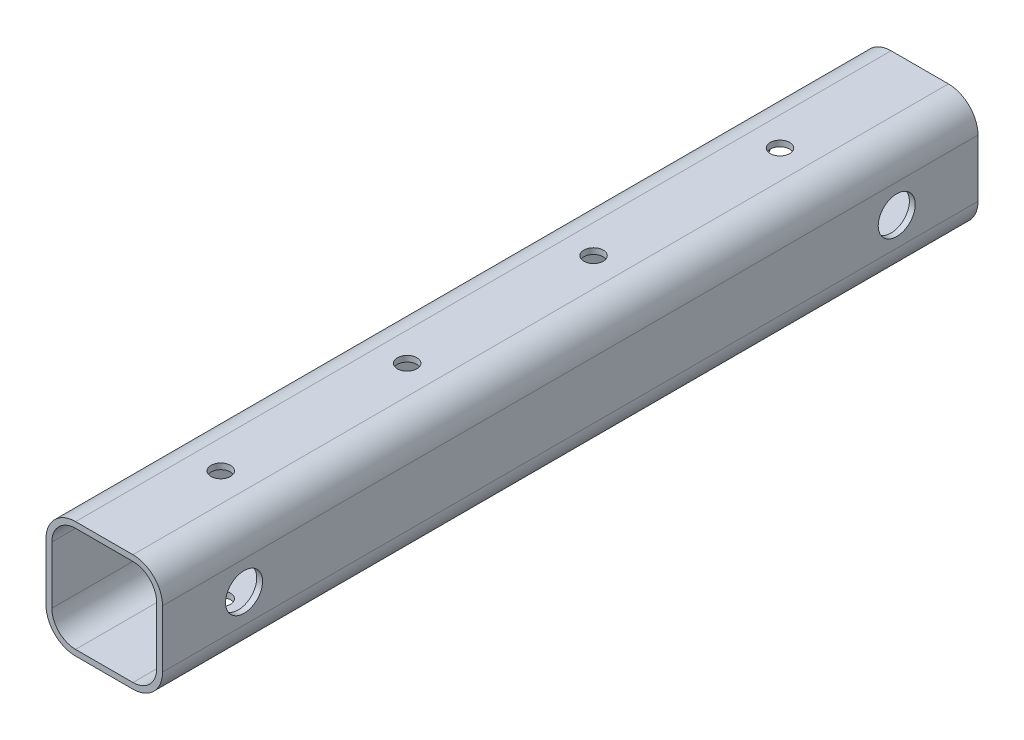
from build123d import *

# Parameters (mm, degrees)
SQUARE_TUBE_2_X_2_X_0_25_1_DEPTH = 350
CUT_EXTRUDE1_REACH               = 356.436
SKETCH16_R                       = 7.9375
CUT_EXTRUDE2_REACH               = 356.436
SKETCH18_R                       = 7.9375
CUT_EXTRUDE3_REACH               = 356.436
SKETCH19_R                       = 4.1671875


with BuildPart() as part:
    # Sketch15 → Square tube 2 X 2 X 0.25(1) (new body)
    with BuildSketch(Plane.YX):
        with BuildLine():
            Line((-12.3, -25), (12.3, -25))
            ThreePointArc((12.3, -25), (21.280256121, -21.280256121), (25, -12.3))
            Line((25, -12.3), (25, 12.3))
            ThreePointArc((25, 12.3), (21.280256121, 21.280256121), (12.3, 25))
            Line((12.3, 25), (-12.3, 25))
            ThreePointArc((-12.3, 25), (-21.280256121, 21.280256121), (-25, 12.3))
            Line((-25, 12.3), (-25, -12.3))
            ThreePointArc((-25, -12.3), (-21.280256121, -21.280256121), (-12.3, -25))
        make_face()
        with BuildLine():
            Line((-12.3, -22.5), (12.3, -22.5))
            ThreePointArc((12.3, -22.5), (19.512489168, -19.512489168), (22.5, -12.3))
            Line((22.5, -12.3), (22.5, 12.3))
            ThreePointArc((22.5, 12.3), (19.512489168, 19.512489168), (12.3, 22.5))
            Line((12.3, 22.5), (-12.3, 22.5))
            ThreePointArc((-12.3, 22.5), (-19.512489168, 19.512489168), (-22.5, 12.3))
            Line((-22.5, 12.3), (-22.5, -12.3))
            ThreePointArc((-22.5, -12.3), (-19.512489168, -19.512489168), (-12.3, -22.5))
        make_face(mode=Mode.SUBTRACT)
    extrude(amount=SQUARE_TUBE_2_X_2_X_0_25_1_DEPTH)

    # Cut-Extrude1: up to this face of the body (flat: up to its plane)
    cut_extrude1_end = Plane(part.part.faces().sort_by_distance((25, 0, -175))[0])
    # Sketch16 → Cut-Extrude1 (cut, up to the picked face)
    with BuildSketch(Plane.ZY.offset(25), mode=Mode.PRIVATE) as cut_extrude1_sk1:
        with Locations((-35, 0)):
            Circle(SKETCH16_R)
    cut_extrude1_tool1 = split(extrude(cut_extrude1_sk1.sketch, amount=-CUT_EXTRUDE1_REACH, mode=Mode.PRIVATE), bisect_by=cut_extrude1_end, keep=Keep.BOTH, mode=Mode.PRIVATE)
    add(cut_extrude1_tool1.solids().sort_by(Axis((-25, 0, -35), (1, 0, 0)))[0], mode=Mode.SUBTRACT)

    # Cut-Extrude2: up to this face of the body (flat: up to its plane)
    cut_extrude2_end = Plane(part.part.faces().sort_by_distance((25, 0, -178.294144468))[0])
    # Sketch18 → Cut-Extrude2 (cut, up to the picked face)
    with BuildSketch(Plane.ZY.offset(25), mode=Mode.PRIVATE) as cut_extrude2_sk1:
        with Locations((-315.113369307, 0)):
            Circle(SKETCH18_R)
    cut_extrude2_tool1 = split(extrude(cut_extrude2_sk1.sketch, amount=-CUT_EXTRUDE2_REACH, mode=Mode.PRIVATE), bisect_by=cut_extrude2_end, keep=Keep.BOTH, mode=Mode.PRIVATE)
    add(cut_extrude2_tool1.solids().sort_by(Axis((-25, 0, -315.113369), (1, 0, 0)))[0], mode=Mode.SUBTRACT)

    # Cut-Extrude3: up to this face of the body (flat: up to its plane)
    cut_extrude3_end = Plane(part.part.faces().sort_by_distance((0, -25, -175))[0])
    # Sketch19 → Cut-Extrude3 (cut, up to the picked face)
    with BuildSketch(Plane(origin=(0, 25, 0), x_dir=(-1, 0, 0), z_dir=(0, 1, 0)), mode=Mode.PRIVATE) as cut_extrude3_sk1:
        with Locations(Location((0, -290, 0), (0, 0, 90))):
            Circle(SKETCH19_R)
    cut_extrude3_tool1 = split(extrude(cut_extrude3_sk1.sketch, amount=-CUT_EXTRUDE3_REACH, mode=Mode.PRIVATE), bisect_by=cut_extrude3_end, keep=Keep.BOTH, mode=Mode.PRIVATE)
    # Sketch19 → Cut-Extrude3 (cut, up to the picked face)
    with BuildSketch(Plane(origin=(0, 25, 0), x_dir=(-1, 0, 0), z_dir=(0, 1, 0)), mode=Mode.PRIVATE) as cut_extrude3_sk2:
        with Locations(Location((0, -210, 0), (0, 0, 90))):
            Circle(SKETCH19_R)
    cut_extrude3_tool2 = split(extrude(cut_extrude3_sk2.sketch, amount=-CUT_EXTRUDE3_REACH, mode=Mode.PRIVATE), bisect_by=cut_extrude3_end, keep=Keep.BOTH, mode=Mode.PRIVATE)
    # Sketch19 → Cut-Extrude3 (cut, up to the picked face)
    with BuildSketch(Plane(origin=(0, 25, 0), x_dir=(-1, 0, 0), z_dir=(0, 1, 0)), mode=Mode.PRIVATE) as cut_extrude3_sk3:
        with Locations(Location((0, -130, 0), (0, 0, 90))):
            Circle(SKETCH19_R)
    cut_extrude3_tool3 = split(extrude(cut_extrude3_sk3.sketch, amount=-CUT_EXTRUDE3_REACH, mode=Mode.PRIVATE), bisect_by=cut_extrude3_end, keep=Keep.BOTH, mode=Mode.PRIVATE)
    # Sketch19 → Cut-Extrude3 (cut, up to the picked face)
    with BuildSketch(Plane(origin=(0, 25, 0), x_dir=(-1, 0, 0), z_dir=(0, 1, 0)), mode=Mode.PRIVATE) as cut_extrude3_sk4:
        with Locations(Location((0, -50, 0), (0, 0, 90))):
            Circle(SKETCH19_R)
    cut_extrude3_tool4 = split(extrude(cut_extrude3_sk4.sketch, amount=-CUT_EXTRUDE3_REACH, mode=Mode.PRIVATE), bisect_by=cut_extrude3_end, keep=Keep.BOTH, mode=Mode.PRIVATE)
    add(cut_extrude3_tool1.solids().sort_by(Axis((0, 25, -290), (0, -1, 0)))[0], mode=Mode.SUBTRACT)
    add(cut_extrude3_tool2.solids().sort_by(Axis((0, 25, -210), (0, -1, 0)))[0], mode=Mode.SUBTRACT)
    add(cut_extrude3_tool3.solids().sort_by(Axis((0, 25, -130), (0, -1, 0)))[0], mode=Mode.SUBTRACT)
    add(cut_extrude3_tool4.solids().sort_by(Axis((0, 25, -50), (0, -1, 0)))[0], mode=Mode.SUBTRACT)


solid = part.part
